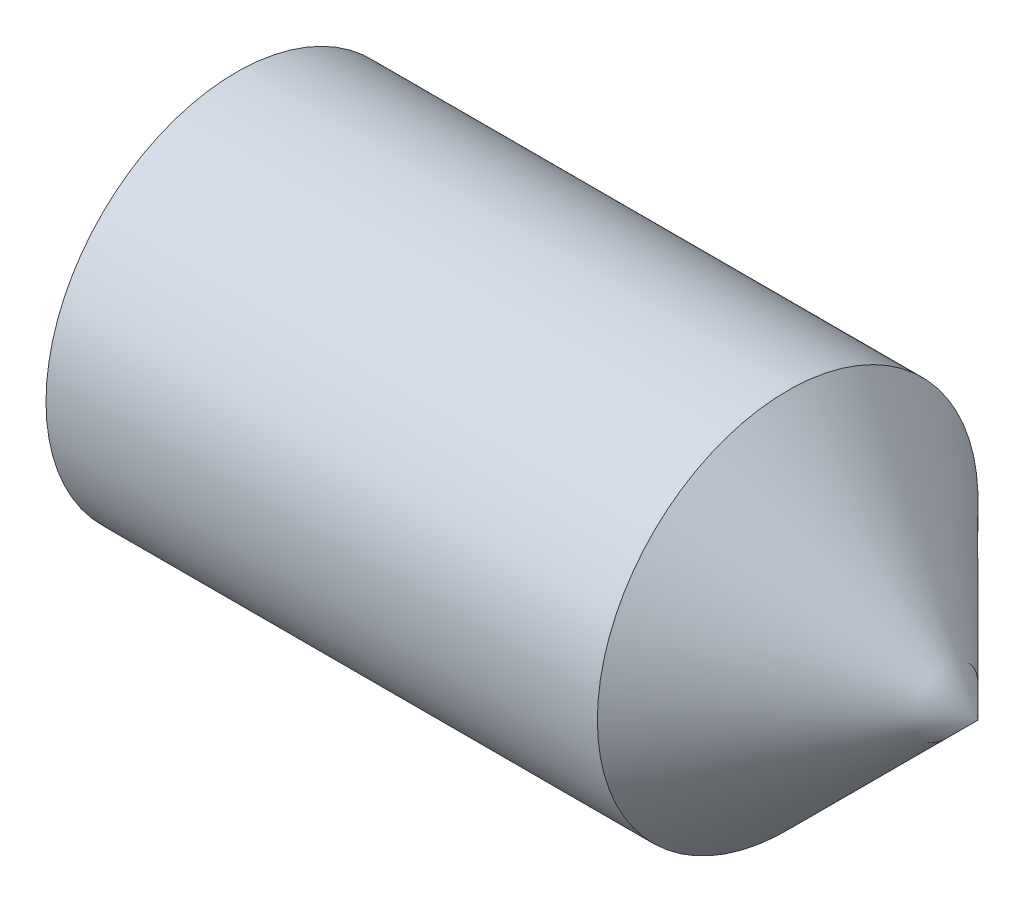
from build123d import *

# Parameters (mm, degrees)
HEX_2_DEPTH = 3


with BuildPart() as part:
    # BodySke → BaseBody (revolve)
    with BuildSketch(Plane.XY, mode=Mode.PRIVATE) as basebody_sk:
        Polygon((0, 0), (0, 2.055), (0.25692087, 2.5), (7.5, 2.5), (10, 0), align=None)
    revolve(basebody_sk.sketch.rotate(Axis((-12.7, 0, 0), (1, 0, 0)), 90), axis=Axis((-12.7, 0, 0), (1, 0, 0)))

    # Sketch2 → Hex 2 (cut)
    with BuildSketch(Plane.ZY):
        Polygon((0.721687836, 1.25), (-0.721687836, 1.25), (-1.443375673, 0), (-0.721687836, -1.25), (0.721687836, -1.25), (1.443375673, 0), align=None)
    extrude(amount=-HEX_2_DEPTH, mode=Mode.SUBTRACT)


solid = part.part
